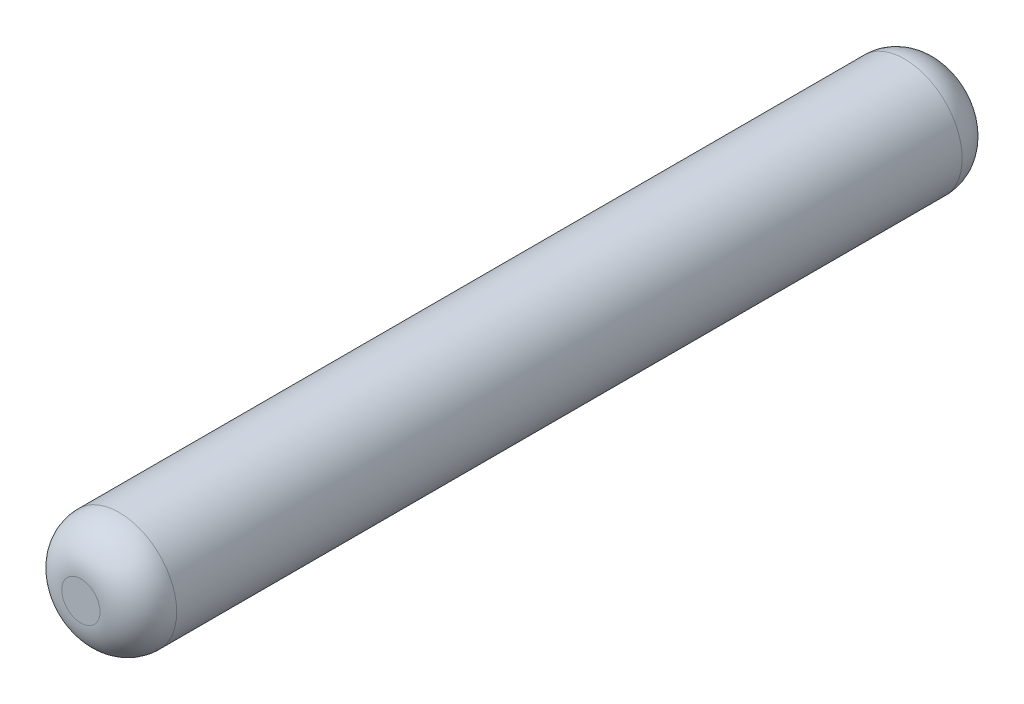
from build123d import *

# Parameters (mm, degrees)
SKETCH1_R           = 3
BOSS_EXTRUDE1_DEPTH = 45
FILLET1_R           = 2


with BuildPart() as part:
    # Sketch1 → Boss-Extrude1 (new body)
    with BuildSketch(Plane.XY):
        with Locations(Location((0, 0, 0), (0, 0, 180))):
            Circle(SKETCH1_R)
    extrude(amount=BOSS_EXTRUDE1_DEPTH)

    # Fillet1
    fillet1_edges = [part.edges().sort_by_distance(p)[0] for p in [
        (3, 0, 0),
        (3, 0, 45),
    ]]
    fillet(fillet1_edges, radius=FILLET1_R)


solid = part.part
